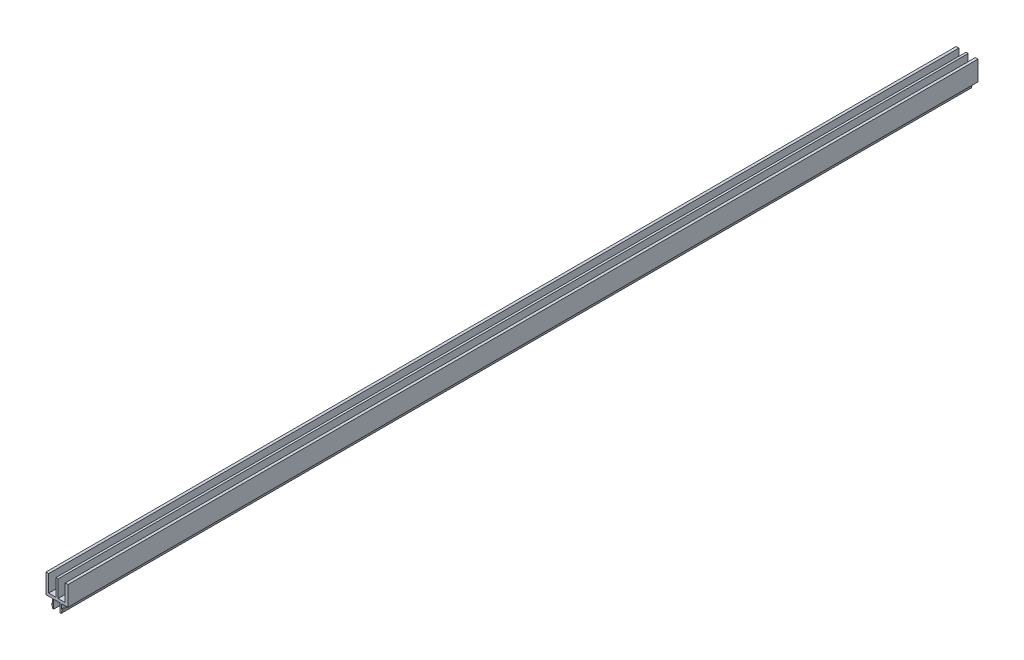
from build123d import *

# Parameters (mm, degrees)
BOSS_EXTRU_1_DEPTH = 832


with BuildPart() as part:
    # Esquisse1 → Boss.-Extru.1 (new body)
    with BuildSketch(Plane.XY.offset(50)):
        Polygon((-1, 2.5), (-7.5, 2.5), (-7.5, 17.999999998), (-10, 17.999999998), (-10, 0), (-4, 0), (-4, -4.5), (-5, -4.5), (-3.75, -8), (-3, -8), (-3, 0), (3, 0), (3, -8), (3.75, -8), (5, -4.5), (4, -4.5), (4, 0), (10, 0), (10, 17.999999998), (7.5, 17.999999998), (7.5, 2.5), (1, 2.5), (1, 17.999999998), (-1, 17.999999998), align=None)
    extrude(amount=-BOSS_EXTRU_1_DEPTH)


solid = part.part
